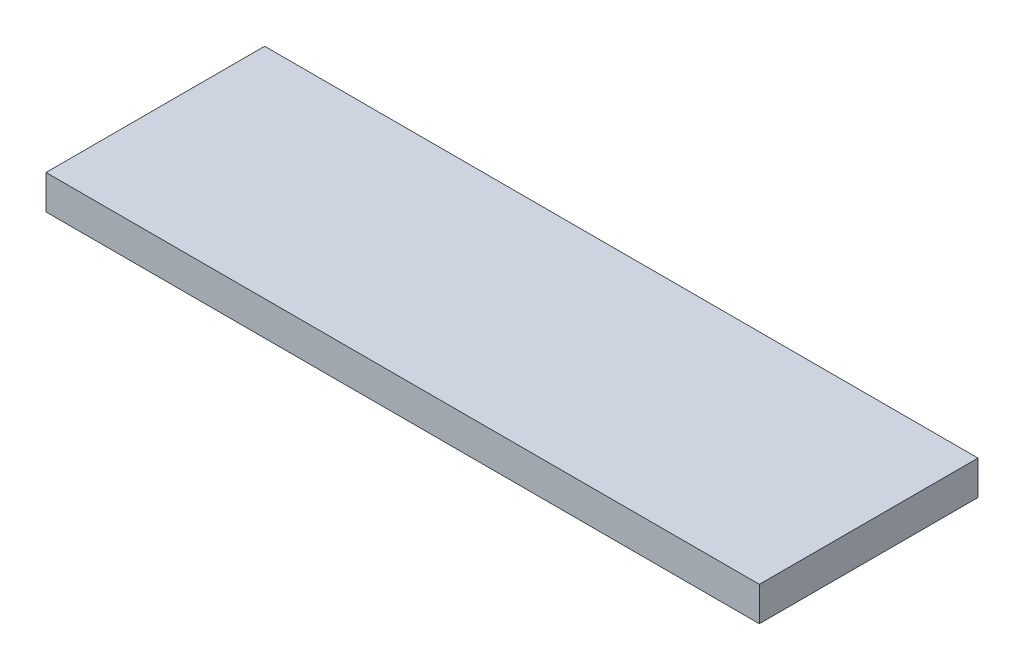
from build123d import *

# Parameters (mm, degrees)
SKETCH1_W           = 132.588
SKETCH1_H           = 40.64
BOSS_EXTRUDE1_DEPTH = 6.35


with BuildPart() as part:
    # Sketch1 → Boss-Extrude1 (new body)
    with BuildSketch(Plane(origin=(0, 0, 0), x_dir=(1, 0, 0), z_dir=(0, 1, 0))):
        with Locations((66.294, 20.32)):
            Rectangle(SKETCH1_W, SKETCH1_H)
    extrude(amount=BOSS_EXTRUDE1_DEPTH)


solid = part.part
